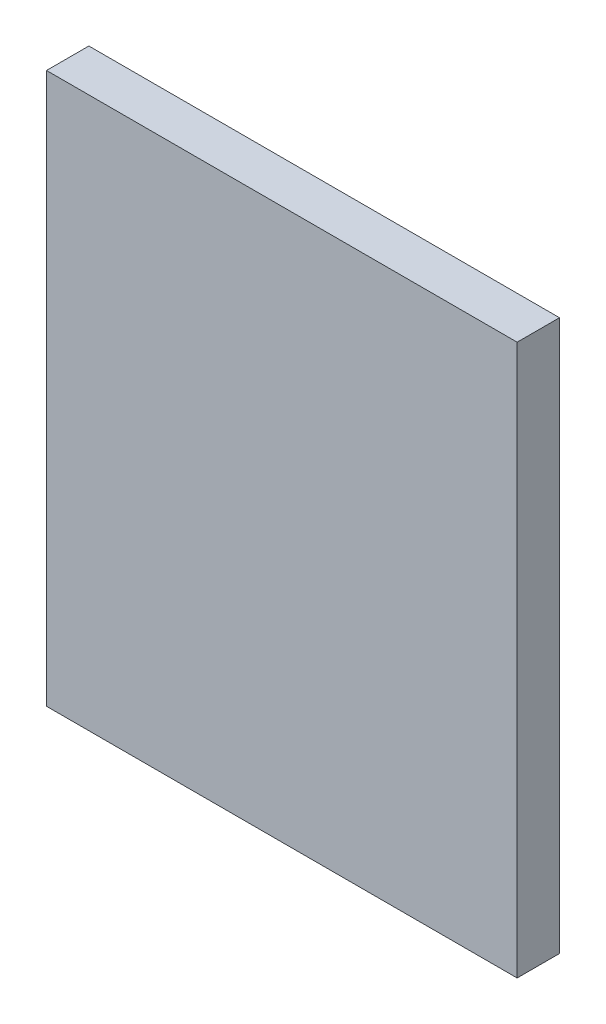
from build123d import *

# Parameters (mm, degrees)
SKETCH1_W           = 200
SKETCH1_H           = 234
BOSS_EXTRUDE1_DEPTH = 18


with BuildPart() as part:
    # Sketch1 → Boss-Extrude1 (new body)
    with BuildSketch(Plane.XY):
        Rectangle(SKETCH1_W, SKETCH1_H)
    extrude(amount=BOSS_EXTRUDE1_DEPTH)


solid = part.part
